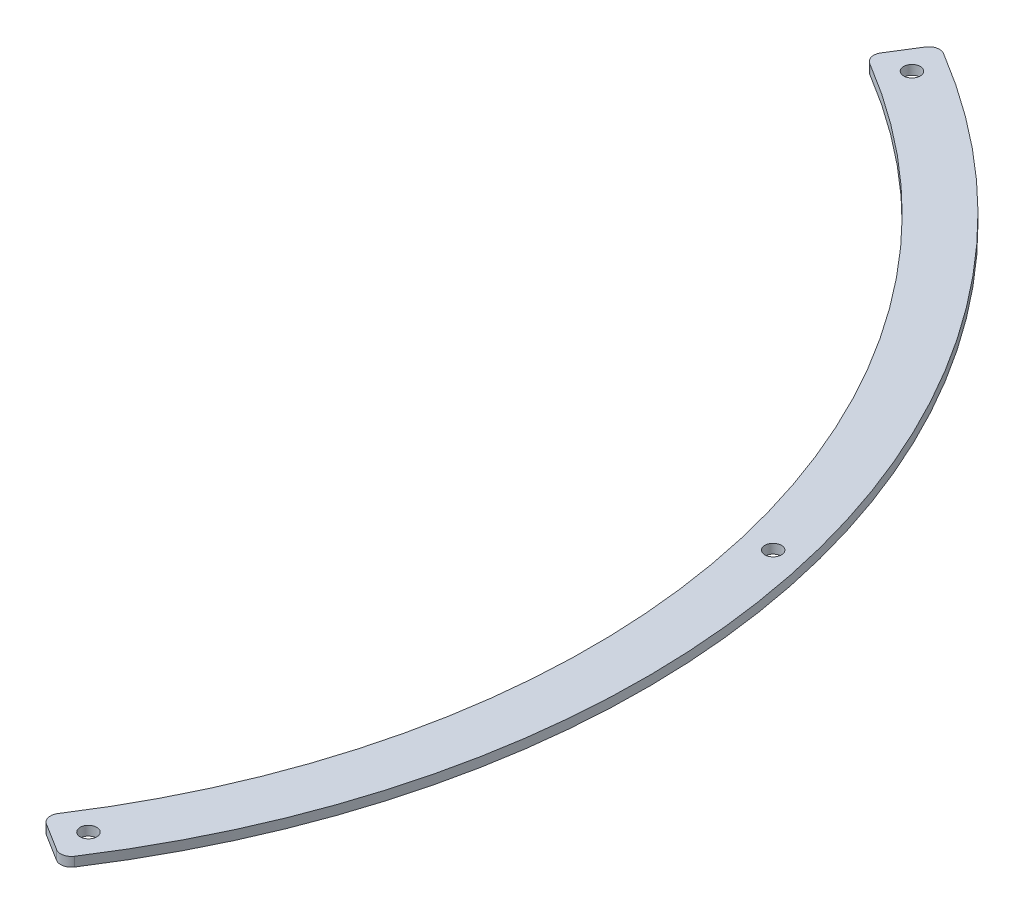
from build123d import *

# Parameters (mm, degrees)
BOSS_EXTRUDE1_DEPTH  = 1.75
MOUNTING_HOLES_REACH = 199.898
SKETCH2_R            = 1.55


with BuildPart() as part:
    # Sketch1 → Boss-Extrude1 (new body)
    with BuildSketch(Plane(origin=(0, 0, 0), x_dir=(1, 0, 0), z_dir=(0, 1, 0))):
        with BuildLine():
            Line((70.99149995, 123.045548212), (74.17169656, 128.134926657))
            ThreePointArc((74.17169656, 128.134926657), (75.398161995, 129.019168104), (76.893033195, 128.792319049))
            ThreePointArc((76.893033195, 128.792319049), (146.155509718, 33.742658152), (125.569837037, -82.050082429))
            ThreePointArc((125.569837037, -82.050082429), (124.325699782, -82.909281411), (122.835734015, -82.652177522))
            Line((122.835734015, -82.652177522), (117.74635557, -79.471980911))
            ThreePointArc((117.74635557, -79.471980911), (116.852809957, -78.205175291), (117.132867421, -76.680449723))
            ThreePointArc((117.132867421, -76.680449723), (136.41180907, 31.493147608), (71.663827182, 120.267601097))
            ThreePointArc((71.663827182, 120.267601097), (70.743717505, 121.515246248), (70.99149995, 123.045548212))
        make_face()
    extrude(amount=BOSS_EXTRUDE1_DEPTH)

    # Sketch2 → Mounting_Holes (cut, up to next)
    with BuildSketch(Plane(origin=(0, 1.75, 0), x_dir=(1, 0, 0), z_dir=(0, 1, 0)), mode=Mode.PRIVATE) as mounting_holes_sk1:
        with Locations(Location((122.966973943, -76.838293314, 0), (0, 0, 270))):
            Circle(SKETCH2_R)
    mounting_holes_tool1 = extrude(mounting_holes_sk1.sketch, amount=-MOUNTING_HOLES_REACH, mode=Mode.PRIVATE) & part.part
    # Sketch2 → Mounting_Holes (cut, up to next)
    with BuildSketch(Plane(origin=(0, 1.75, 0), x_dir=(1, 0, 0), z_dir=(0, 1, 0)), mode=Mode.PRIVATE) as mounting_holes_sk2:
        with Locations(Location((141.283659394, 32.61790288, 0), (0, 0, 270))):
            Circle(SKETCH2_R)
    mounting_holes_tool2 = extrude(mounting_holes_sk2.sketch, amount=-MOUNTING_HOLES_REACH, mode=Mode.PRIVATE) & part.part
    # Sketch2 → Mounting_Holes (cut, up to next)
    with BuildSketch(Plane(origin=(0, 1.75, 0), x_dir=(1, 0, 0), z_dir=(0, 1, 0)), mode=Mode.PRIVATE) as mounting_holes_sk3:
        with Locations(Location((76.838293314, 122.966973943, 0), (0, 0, 270))):
            Circle(SKETCH2_R)
    mounting_holes_tool3 = extrude(mounting_holes_sk3.sketch, amount=-MOUNTING_HOLES_REACH, mode=Mode.PRIVATE) & part.part
    add(mounting_holes_tool1.solids().sort_by_distance((122.966974, 1.75, 76.838293))[0], mode=Mode.SUBTRACT)
    add(mounting_holes_tool2.solids().sort_by_distance((141.283659, 1.75, -32.617903))[0], mode=Mode.SUBTRACT)
    add(mounting_holes_tool3.solids().sort_by_distance((76.838293, 1.75, -122.966974))[0], mode=Mode.SUBTRACT)


solid = part.part
